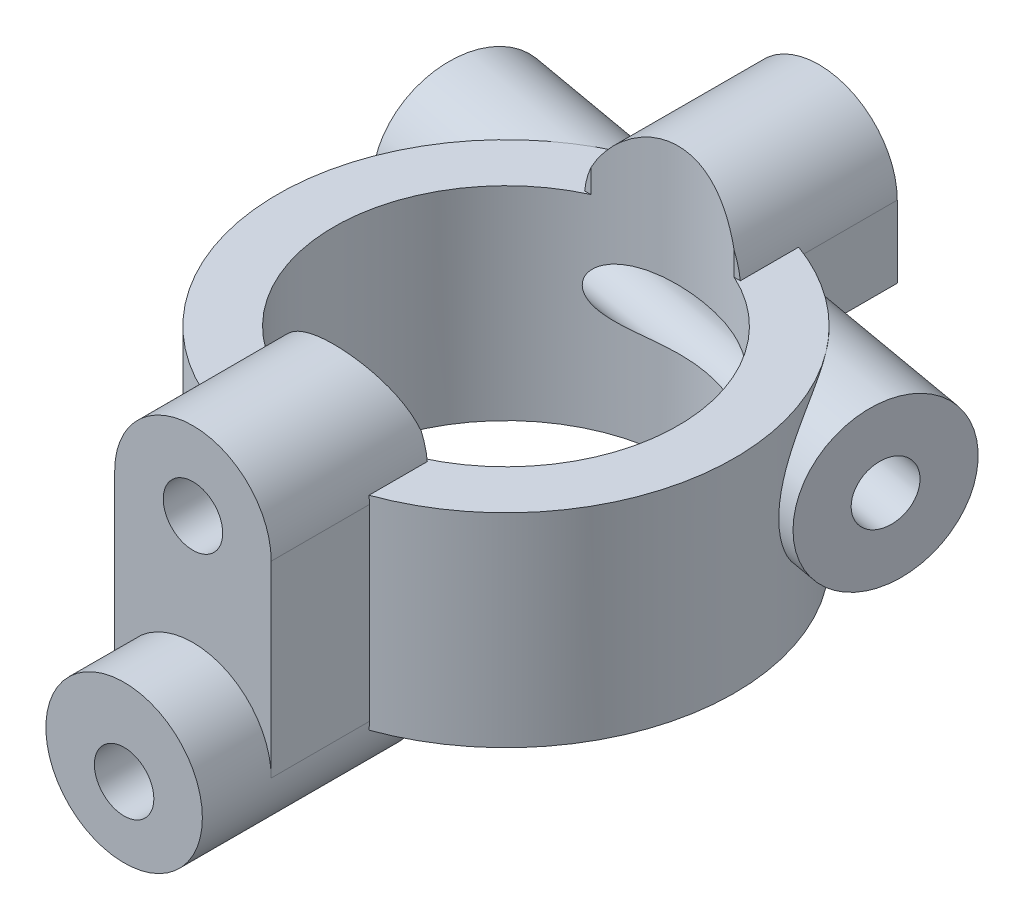
from build123d import *

# Parameters (mm, degrees)
SKETCH1_R                = 9.271
BOSS_EXTRUDE1_DEPTH      = 8.255
BOSS_EXTRUDE2_DEPTH      = 6.35
BOSS_EXTRUDE4_DEPTH      = 6.35
SKETCH4_R                = 3.175
BOSS_EXTRUDE3_DEPTH      = 2.794
BOSS_EXTRUDE5_DEPTH      = 2.5019
BOSS_EXTRUDE5_DEPTH_BACK = 18.542
SKETCH9_R                = 3.242754444
CUT_EXTRUDE9_DEPTH       = 19.304
CUT_EXTRUDE9_DEPTH_BACK  = 19.304
SKETCH11_R               = 6.985
CUT_EXTRUDE10_REACH      = 34.231
SKETCH6_R                = 1.2065
SKETCH12_R               = 1.2065
CUT_EXTRUDE11_DEPTH      = 31.592851761
SKETCH5_R                = 1.2065
CUT_EXTRUDE12_DEPTH      = 3.81


with BuildPart() as part:
    # Sketch1 → Boss-Extrude1 (new body)
    with BuildSketch(Plane(origin=(0, 0, 0), x_dir=(1, 0, 0), z_dir=(0, 1, 0))):
        Circle(SKETCH1_R)
    extrude(amount=BOSS_EXTRUDE1_DEPTH)

    # Sketch2 → Boss-Extrude2 (add)
    with BuildSketch(Plane.XY.offset(6.35)):
        with BuildLine():
            Line((3.175, 0.3175), (3.175, 7.9375))
            ThreePointArc((3.175, 7.9375), (0, 11.1125), (-3.175, 7.9375))
            Line((-3.175, 7.9375), (-3.175, 0.3175))
            ThreePointArc((-3.175, 0.3175), (0, -2.8575), (3.175, 0.3175))
        make_face()
    extrude(amount=BOSS_EXTRUDE2_DEPTH)

    # Sketch7 → Boss-Extrude4 (add)
    with BuildSketch(Plane.XY.offset(-6.35)):
        with BuildLine():
            Line((3.175, 7.9248), (3.175, 5.0038))
            Line((3.175, 5.0038), (1.244340789, 5.0038))
            ThreePointArc((1.244340789, 5.0038), (0, 4.7498), (-1.244340789, 5.0038))
            Line((-1.244340789, 5.0038), (-3.175, 5.0038))
            Line((-3.175, 5.0038), (-3.175, 7.9248))
            ThreePointArc((-3.175, 7.9248), (0, 11.0998), (3.175, 7.9248))
        make_face()
    extrude(amount=-BOSS_EXTRUDE4_DEPTH)

    # Sketch4 → Boss-Extrude3 (add)
    with BuildSketch(Plane.XY.offset(12.7)):
        with Locations((0, 0.3175)):
            Circle(SKETCH4_R)
    extrude(amount=BOSS_EXTRUDE3_DEPTH)

    # Sketch9 → Boss-Extrude5 (add, two sides: drawn at the far end of the back side and taken through both)
    with BuildSketch(Plane(origin=(-9.130152678, 0, -1.609892255), x_dir=(-0.17364817766692747, 0, 0.9848077530122086), z_dir=(-0.9848077530122086, 0, -0.17364817766692747)).offset(-BOSS_EXTRUDE5_DEPTH_BACK)):
        with Locations((-6.803312487, 5.012245556)):
            Circle(SKETCH9_R)
    extrude(amount=BOSS_EXTRUDE5_DEPTH + BOSS_EXTRUDE5_DEPTH_BACK)

    # Sketch11 → Cut-Extrude9 (cut, two sides: drawn at the far end of the back side and taken through both)
    with BuildSketch(Plane(origin=(0, 8.255, 0), x_dir=(1, 0, 0), z_dir=(0, 1, 0)).offset(-CUT_EXTRUDE9_DEPTH_BACK)):
        Circle(SKETCH11_R)
    extrude(amount=CUT_EXTRUDE9_DEPTH + CUT_EXTRUDE9_DEPTH_BACK, mode=Mode.SUBTRACT)

    # Sketch6 → Cut-Extrude10 (cut, up to next)
    with BuildSketch(Plane.XY.offset(15.494), mode=Mode.PRIVATE) as cut_extrude10_sk1:
        Circle(SKETCH6_R)
    cut_extrude10_tool1 = extrude(cut_extrude10_sk1.sketch, amount=-CUT_EXTRUDE10_REACH, mode=Mode.PRIVATE) & part.part
    add(cut_extrude10_tool1.solids().sort_by_distance((0, 0, 15.494))[0], mode=Mode.SUBTRACT)

    # Sketch12 → Cut-Extrude11 (cut, through all)
    with BuildSketch(Plane(origin=(-11.594043195, 0, -2.044342631), x_dir=(-0.1736481776669275, 0, 0.9848077530122086), z_dir=(-0.9848077530122086, 0, -0.1736481776669275))):
        with Locations((-6.803312487, 5.012245556)):
            Circle(SKETCH12_R)
    extrude(amount=-CUT_EXTRUDE11_DEPTH, mode=Mode.SUBTRACT)

    # Sketch5 → Cut-Extrude12 (cut)
    with BuildSketch(Plane.XY.offset(12.7)):
        with Locations((0, 7.9375)):
            Circle(SKETCH5_R)
    cut_extrude12 = extrude(amount=-CUT_EXTRUDE12_DEPTH, mode=Mode.SUBTRACT)

    # Mirror2: Cut-Extrude12 across plane
    add(cut_extrude12.mirror(Plane.XY), mode=Mode.SUBTRACT)


solid = part.part
